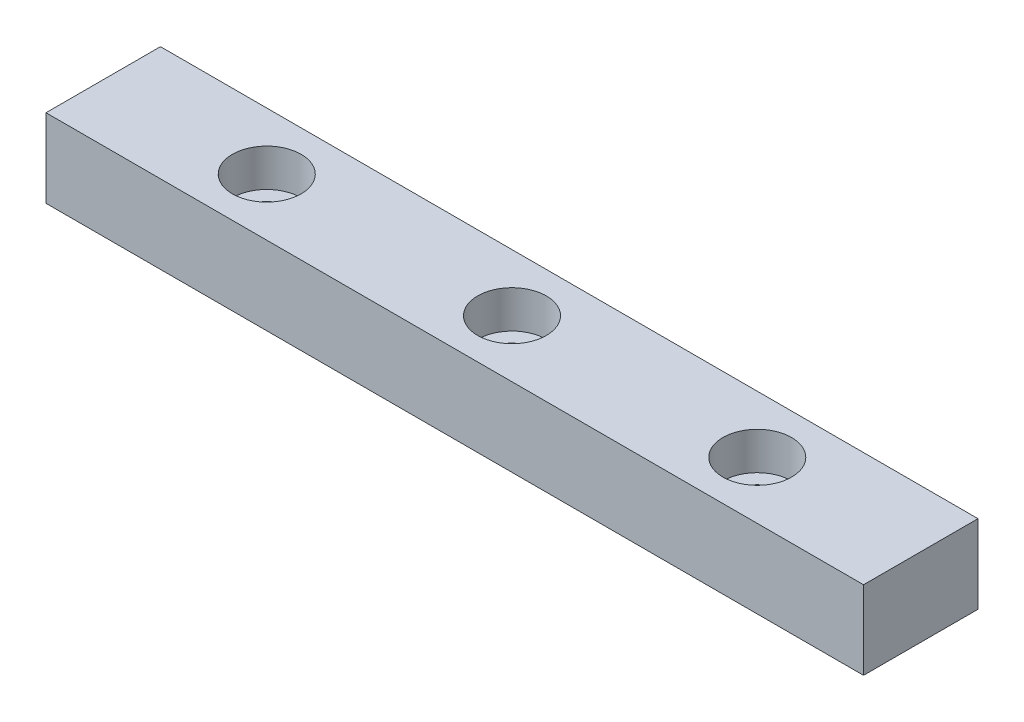
from build123d import *

# Parameters (mm, degrees)
SKETCH_1_W          = 50
SKETCH_1_H          = 7
EXTRUDE_1_DEPTH     = 4.8
SKETCH_2_R          = 2.1
CUT_EXTRUDE_1_DEPTH = 2.3
SKETCH_3_R          = 1.2
CUT_EXTRUDE_2_DEPTH = 26.367301788


with BuildPart() as part:
    # 草图1 → 凸台-拉伸1 (new body)
    with BuildSketch(Plane(origin=(0, 0, 0), x_dir=(1, 0, 0), z_dir=(0, 1, 0))):
        Rectangle(SKETCH_1_W, SKETCH_1_H)
    extrude(amount=EXTRUDE_1_DEPTH)

    # 草图2 → 切除-拉伸1 (cut)
    with BuildSketch(Plane(origin=(0, 4.8, 0), x_dir=(1, 0, 0), z_dir=(0, 1, 0))):
        with Locations(Location((0, 0, 0), (0, 0, 270))):
            Circle(SKETCH_2_R)
        with Locations(Location((-15, 0, 0), (0, 0, 270))):
            Circle(SKETCH_2_R)
        with Locations(Location((15, 0, 0), (0, 0, 270))):
            Circle(SKETCH_2_R)
    extrude(amount=-CUT_EXTRUDE_1_DEPTH, mode=Mode.SUBTRACT)

    # 草图3 → 切除-拉伸2 (cut, through all)
    with BuildSketch(Plane(origin=(0, 2.5, 0), x_dir=(1, 0, 0), z_dir=(0, 1, 0))):
        with Locations(Location((0, 0, 0), (0, 0, 270))):
            Circle(SKETCH_3_R)
        with Locations(Location((-15, 0, 0), (0, 0, 270))):
            Circle(SKETCH_3_R)
        with Locations(Location((15, 0, 0), (0, 0, 270))):
            Circle(SKETCH_3_R)
    extrude(amount=-CUT_EXTRUDE_2_DEPTH, mode=Mode.SUBTRACT)


solid = part.part
